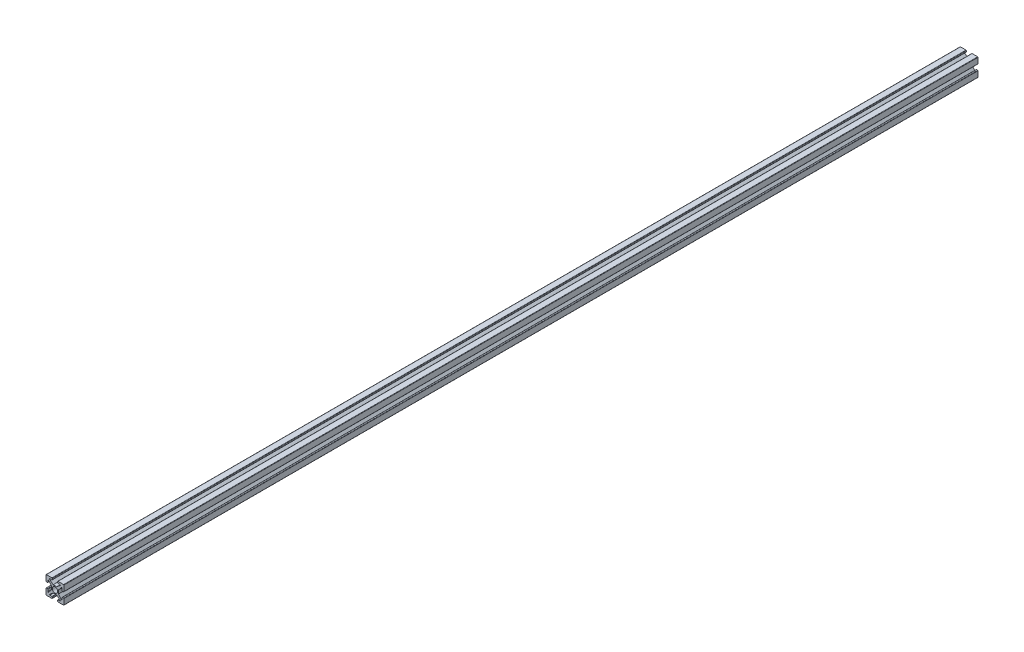
from build123d import *

# Parameters (mm, degrees)
SKETCH1_R           = 1.5
BOSS_EXTRUDE1_DEPTH = 511


with BuildPart() as part:
    # Sketch1 → Boss-Extrude1 (new body)
    with BuildSketch(Plane.XY):
        with BuildLine():
            Line((-4.8, 5), (-1.7, 5))
            ThreePointArc((-1.7, 5), (-1.558578644, 4.941421356), (-1.5, 4.8))
            Line((-1.5, 4.8), (-1.5, 4.2))
            ThreePointArc((-1.5, 4.2), (-1.558578644, 4.058578644), (-1.7, 4))
            Line((-1.7, 4), (-2.834011701, 4))
            ThreePointArc((-2.834011701, 4), (-3.021950225, 3.868404029), (-2.962569223, 3.646791111))
            Line((-2.962569223, 3.646791111), (-1, 2))
            Line((-1, 2), (1, 2))
            Line((1, 2), (2.962569223, 3.646791111))
            ThreePointArc((2.962569223, 3.646791111), (3.021950225, 3.868404029), (2.834011701, 4))
            Line((2.834011701, 4), (1.7, 4))
            ThreePointArc((1.7, 4), (1.558578644, 4.058578644), (1.5, 4.2))
            Line((1.5, 4.2), (1.5, 4.8))
            ThreePointArc((1.5, 4.8), (1.558578644, 4.941421356), (1.7, 5))
            Line((1.7, 5), (4.8, 5))
            ThreePointArc((4.8, 5), (4.941421356, 4.941421356), (5, 4.8))
            Line((5, 4.8), (5, 1.7))
            ThreePointArc((5, 1.7), (4.941421356, 1.558578644), (4.8, 1.5))
            Line((4.8, 1.5), (4.2, 1.5))
            ThreePointArc((4.2, 1.5), (4.058578644, 1.558578644), (4, 1.7))
            Line((4, 1.7), (4, 2.834011701))
            ThreePointArc((4, 2.834011701), (3.868404029, 3.021950225), (3.646791111, 2.962569223))
            Line((3.646791111, 2.962569223), (2, 1))
            Line((2, 1), (2, -1))
            Line((2, -1), (3.646791111, -2.962569223))
            ThreePointArc((3.646791111, -2.962569223), (3.868404029, -3.021950225), (4, -2.834011701))
            Line((4, -2.834011701), (4, -1.7))
            ThreePointArc((4, -1.7), (4.058578644, -1.558578644), (4.2, -1.5))
            Line((4.2, -1.5), (4.8, -1.5))
            ThreePointArc((4.8, -1.5), (4.941421356, -1.558578644), (5, -1.7))
            Line((5, -1.7), (5, -4.8))
            ThreePointArc((5, -4.8), (4.941421356, -4.941421356), (4.8, -5))
            Line((4.8, -5), (1.7, -5))
            ThreePointArc((1.7, -5), (1.558578644, -4.941421356), (1.5, -4.8))
            Line((1.5, -4.8), (1.5, -4.2))
            ThreePointArc((1.5, -4.2), (1.558578644, -4.058578644), (1.7, -4))
            Line((1.7, -4), (2.834011701, -4))
            ThreePointArc((2.834011701, -4), (3.021950225, -3.868404029), (2.962569223, -3.646791111))
            Line((2.962569223, -3.646791111), (1, -2))
            Line((1, -2), (-1, -2))
            Line((-1, -2), (-2.962569223, -3.646791111))
            ThreePointArc((-2.962569223, -3.646791111), (-3.021950225, -3.868404029), (-2.834011701, -4))
            Line((-2.834011701, -4), (-1.7, -4))
            ThreePointArc((-1.7, -4), (-1.558578644, -4.058578644), (-1.5, -4.2))
            Line((-1.5, -4.2), (-1.5, -4.8))
            ThreePointArc((-1.5, -4.8), (-1.558578644, -4.941421356), (-1.7, -5))
            Line((-1.7, -5), (-4.8, -5))
            ThreePointArc((-4.8, -5), (-4.941421356, -4.941421356), (-5, -4.8))
            Line((-5, -4.8), (-5, -1.7))
            ThreePointArc((-5, -1.7), (-4.941421356, -1.558578644), (-4.8, -1.5))
            Line((-4.8, -1.5), (-4.2, -1.5))
            ThreePointArc((-4.2, -1.5), (-4.058578644, -1.558578644), (-4, -1.7))
            Line((-4, -1.7), (-4, -2.834011701))
            ThreePointArc((-4, -2.834011701), (-3.868404029, -3.021950225), (-3.646791111, -2.962569223))
            Line((-3.646791111, -2.962569223), (-2, -1))
            Line((-2, -1), (-2, 1))
            Line((-2, 1), (-3.646791111, 2.962569223))
            ThreePointArc((-3.646791111, 2.962569223), (-3.868404029, 3.021950225), (-4, 2.834011701))
            Line((-4, 2.834011701), (-4, 1.7))
            ThreePointArc((-4, 1.7), (-4.058578644, 1.558578644), (-4.2, 1.5))
            Line((-4.2, 1.5), (-4.8, 1.5))
            ThreePointArc((-4.8, 1.5), (-4.941421356, 1.558578644), (-5, 1.7))
            Line((-5, 1.7), (-5, 4.8))
            ThreePointArc((-5, 4.8), (-4.941421356, 4.941421356), (-4.8, 5))
        make_face()
        Circle(SKETCH1_R, mode=Mode.SUBTRACT)
    extrude(amount=BOSS_EXTRUDE1_DEPTH)


solid = part.part
